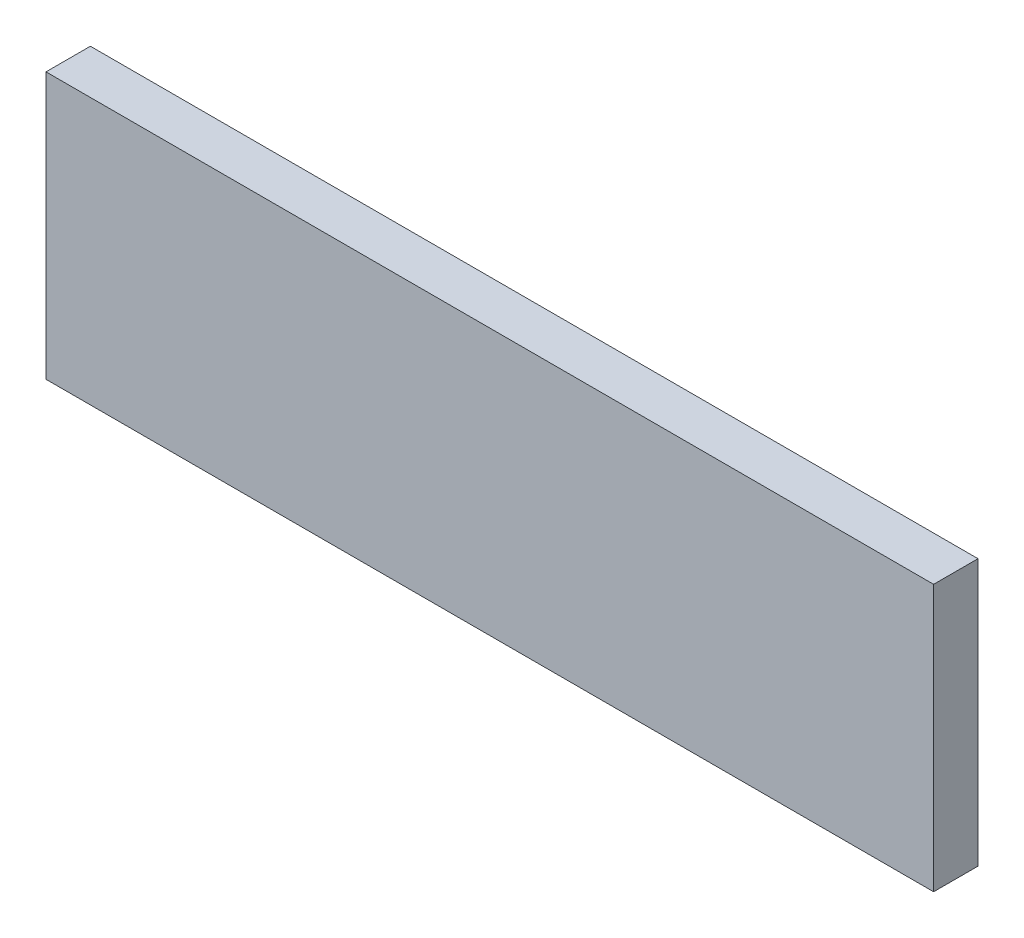
from build123d import *

# Parameters (mm, degrees)
SKETCH1_W           = 100
SKETCH1_H           = 5
BOSS_EXTRUDE1_DEPTH = 30


with BuildPart() as part:
    # Sketch1 → Boss-Extrude1 (new body)
    with BuildSketch(Plane(origin=(0, 0, 0), x_dir=(1, 0, 0), z_dir=(0, 1, 0))):
        with Locations((39.355174511, -2.04872508)):
            Rectangle(SKETCH1_W, SKETCH1_H)
    extrude(amount=BOSS_EXTRUDE1_DEPTH)


solid = part.part
